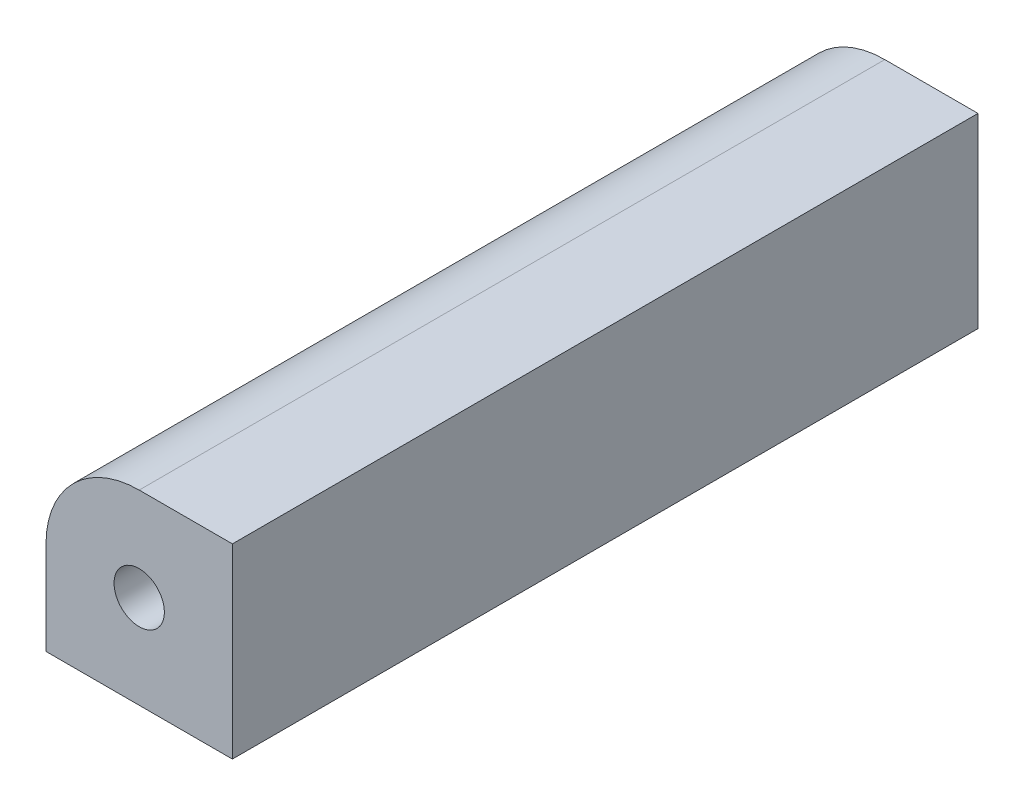
from build123d import *

# Parameters (mm, degrees)
SKETCH1_R           = 1.35
BOSS_EXTRUDE1_DEPTH = 40


with BuildPart() as part:
    # Sketch1 → Boss-Extrude1 (new body)
    with BuildSketch(Plane.XY):
        with BuildLine():
            Line((69, -42.5), (74, -42.5))
            Line((74, -42.5), (74, -52.5))
            Line((74, -52.5), (64, -52.5))
            Line((64, -52.5), (64, -47.5))
            ThreePointArc((64, -47.5), (65.464466094, -43.964466094), (69, -42.5))
        make_face()
        with Locations((69, -47.5)):
            Circle(SKETCH1_R, mode=Mode.SUBTRACT)
    extrude(amount=BOSS_EXTRUDE1_DEPTH)


solid = part.part
